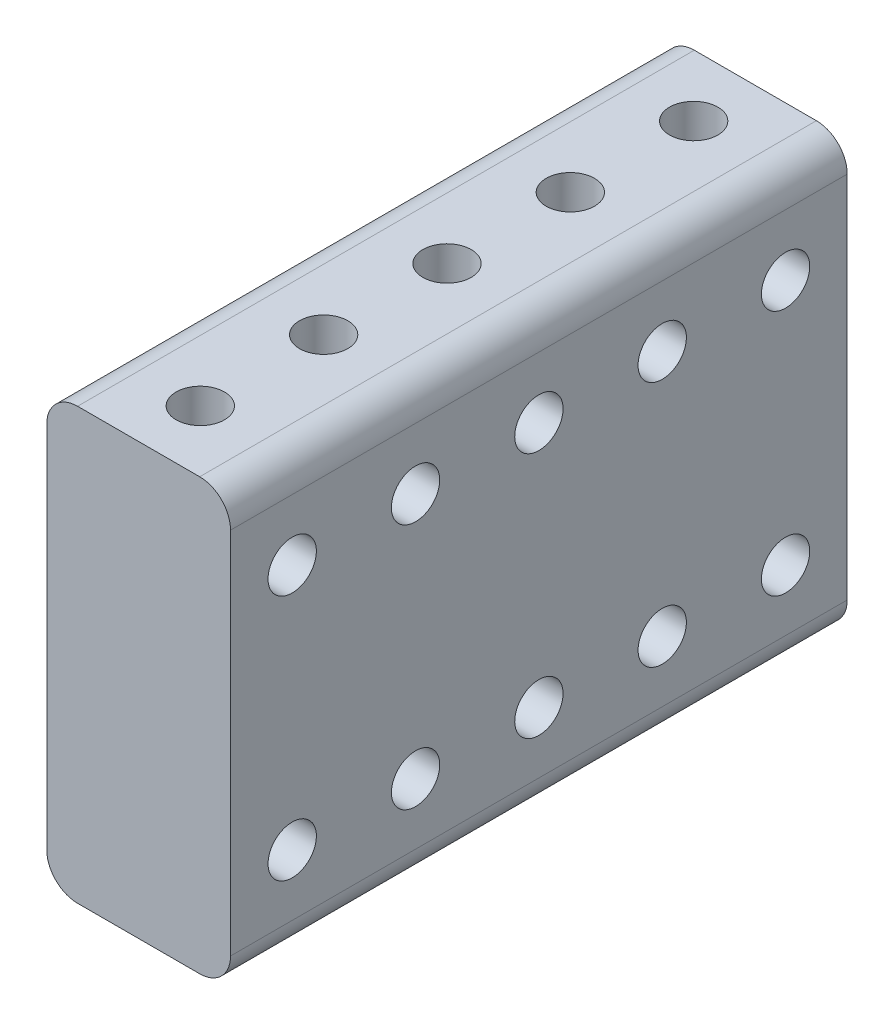
from build123d import *

# Parameters (mm, degrees)
SKETCH1_W           = 18.923
SKETCH1_H           = 44.323
BOSS_EXTRUDE1_DEPTH = 63.5
FILLET1_R           = 3.175
SKETCH2_R           = 2.4892
CUT_EXTRUDE1_DEPTH  = 63.5
SKETCH3_R           = 2.4892
CUT_EXTRUDE2_DEPTH  = 63.5


with BuildPart() as part:
    # Sketch1 → Boss-Extrude1 (new body)
    with BuildSketch(Plane.XY):
        with Locations((9.4615, 22.1615)):
            Rectangle(SKETCH1_W, SKETCH1_H)
    extrude(amount=BOSS_EXTRUDE1_DEPTH)

    # Fillet1
    fillet1_edges = [part.edges().sort_by_distance(p)[0] for p in [
        (0, 44.323, 31.75),
        (18.923, 44.323, 31.75),
        (18.923, 0, 31.75),
        (0, 0, 31.75),
    ]]
    fillet(fillet1_edges, radius=FILLET1_R)

    # Sketch2 → Cut-Extrude1 (cut)
    with BuildSketch(Plane(origin=(0, 44.323, 0), x_dir=(1, 0, 0), z_dir=(0, 1, 0))):
        with Locations(Location((9.4615, -6.35, 0), (0, 0, 270))):
            Circle(SKETCH2_R)
        with Locations(Location((9.4615, -19.05, 0), (0, 0, 270))):
            Circle(SKETCH2_R)
        with Locations(Location((9.4615, -31.75, 0), (0, 0, 270))):
            Circle(SKETCH2_R)
        with Locations(Location((9.4615, -44.45, 0), (0, 0, 270))):
            Circle(SKETCH2_R)
        with Locations(Location((9.4615, -57.15, 0), (0, 0, 270))):
            Circle(SKETCH2_R)
    extrude(amount=-CUT_EXTRUDE1_DEPTH, mode=Mode.SUBTRACT)

    # Sketch3 → Cut-Extrude2 (cut)
    with BuildSketch(Plane(origin=(18.923, 0, 0), x_dir=(0, 0, -1), z_dir=(1, 0, 0))):
        with Locations(Location((-57.15, 34.8615, 0), (0, 0, 90))):
            Circle(SKETCH3_R)
        with Locations(Location((-44.45, 34.8615, 0), (0, 0, 90))):
            Circle(SKETCH3_R)
        with Locations(Location((-31.75, 34.8615, 0), (0, 0, 90))):
            Circle(SKETCH3_R)
        with Locations(Location((-19.05, 34.8615, 0), (0, 0, 90))):
            Circle(SKETCH3_R)
        with Locations(Location((-6.35, 34.8615, 0), (0, 0, 90))):
            Circle(SKETCH3_R)
        with Locations(Location((-44.45, 9.4615, 0), (0, 0, 90))):
            Circle(SKETCH3_R)
        with Locations(Location((-31.75, 9.4615, 0), (0, 0, 90))):
            Circle(SKETCH3_R)
        with Locations(Location((-19.05, 9.4615, 0), (0, 0, 90))):
            Circle(SKETCH3_R)
        with Locations(Location((-6.35, 9.4615, 0), (0, 0, 90))):
            Circle(SKETCH3_R)
        with Locations(Location((-57.15, 9.4615, 0), (0, 0, 90))):
            Circle(SKETCH3_R)
    extrude(amount=-CUT_EXTRUDE2_DEPTH, mode=Mode.SUBTRACT)


solid = part.part
